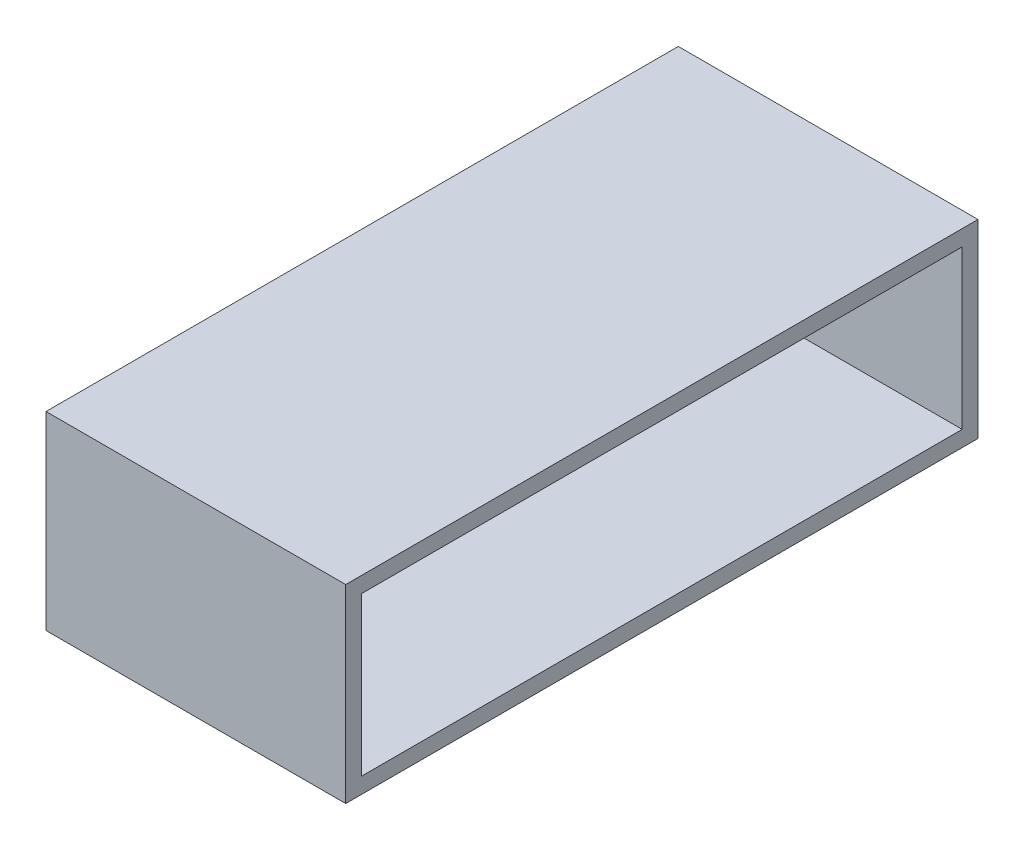
from build123d import *

# Parameters (mm, degrees)
SKETCH1_W           = 948
SKETCH1_H           = 600
BOSS_EXTRUDE1_DEPTH = 2000
SKETCH2_W           = 1900
SKETCH2_H           = 250
CUT_EXTRUDE1_DEPTH  = 2234.540686892


with BuildPart() as part:
    # Sketch1 → Boss-Extrude1 (new body)
    with BuildSketch(Plane.XY):
        Rectangle(SKETCH1_W, SKETCH1_H)
    extrude(amount=BOSS_EXTRUDE1_DEPTH)

    # Sketch2 → Cut-Extrude1 (cut, through all)
    with BuildSketch(Plane(origin=(474, 0, 0), x_dir=(0, 0, -1), z_dir=(1, 0, 0))):
        with Locations((-1000, 125)):
            Rectangle(SKETCH2_W, SKETCH2_H)
        with Locations((-1000, -125)):
            Rectangle(SKETCH2_W, SKETCH2_H)
    extrude(amount=-CUT_EXTRUDE1_DEPTH, mode=Mode.SUBTRACT)


solid = part.part
